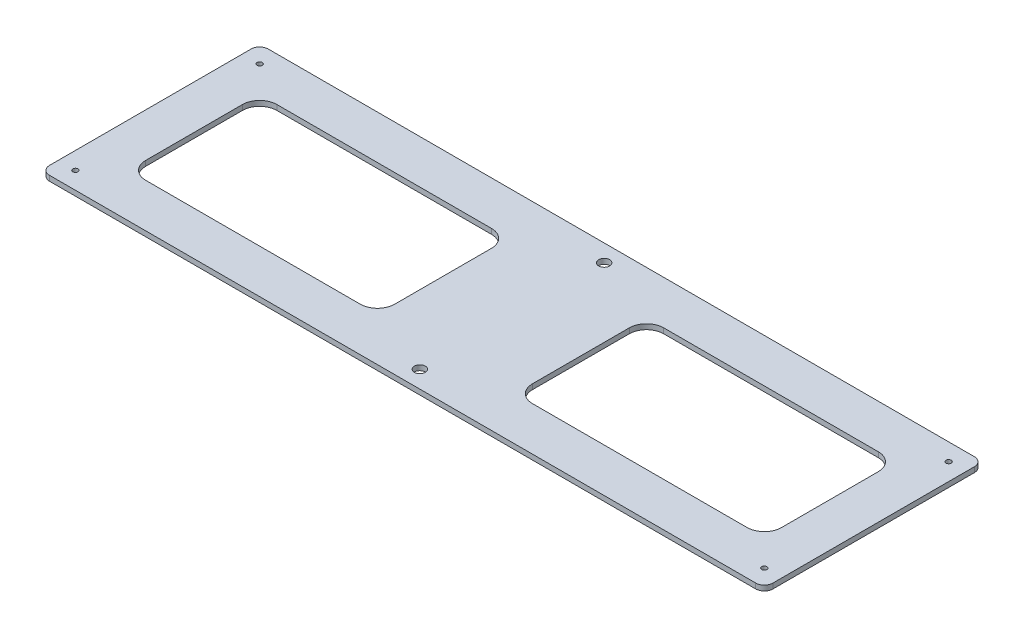
from build123d import *

# Parameters (mm, degrees)
SKETCH1_W           = 420
SKETCH1_H           = 127
BOSS_EXTRUDE1_DEPTH = 3
FILLET1_R           = 5
SKETCH2_R           = 1.5
CUT_EXTRUDE1_DEPTH  = 3
SKETCH3_W           = 144.6
SKETCH3_H           = 76.2
CUT_EXTRUDE2_DEPTH  = 3
FILLET2_R           = 10
SKETCH4_R           = 3.175
CUT_EXTRUDE3_DEPTH  = 10


with BuildPart() as part:
    # Sketch1 → Boss-Extrude1 (new body)
    with BuildSketch(Plane(origin=(0, 0, 0), x_dir=(1, 0, 0), z_dir=(0, 1, 0))):
        Rectangle(SKETCH1_W, SKETCH1_H)
    extrude(amount=BOSS_EXTRUDE1_DEPTH)

    # Fillet1
    fillet1_edges = [part.edges().sort_by_distance(p)[0] for p in [
        (210, 1.5, 63.5),
        (-210, 1.5, 63.5),
        (-210, 1.5, -63.5),
        (210, 1.5, -63.5),
    ]]
    fillet(fillet1_edges, radius=FILLET1_R)

    # Sketch2 → Cut-Extrude1 (cut)
    with BuildSketch(Plane(origin=(0, 3, 0), x_dir=(1, 0, 0), z_dir=(0, 1, 0))):
        with Locations(Location((200, -53.5, 0), (0, 0, 270))):
            Circle(SKETCH2_R)
        with Locations(Location((-200, -53.5, 0), (0, 0, 270))):
            Circle(SKETCH2_R)
        with Locations(Location((-200, 53.5, 0), (0, 0, 270))):
            Circle(SKETCH2_R)
        with Locations(Location((200, 53.5, 0), (0, 0, 270))):
            Circle(SKETCH2_R)
    extrude(amount=-CUT_EXTRUDE1_DEPTH, mode=Mode.SUBTRACT)

    # Sketch3 → Cut-Extrude2 (cut)
    with BuildSketch(Plane(origin=(0, 3, 0), x_dir=(1, 0, 0), z_dir=(0, 1, 0))):
        with Locations((112.3, 0)):
            Rectangle(SKETCH3_W, SKETCH3_H)
        with Locations((-112.3, 0)):
            Rectangle(SKETCH3_W, SKETCH3_H)
    extrude(amount=-CUT_EXTRUDE2_DEPTH, mode=Mode.SUBTRACT)

    # Fillet2
    fillet2_edges = [part.edges().sort_by_distance(p)[0] for p in [
        (-184.6, 1.5, -38.1),
        (-40, 1.5, -38.1),
        (-40, 1.5, 38.1),
        (-184.6, 1.5, 38.1),
        (184.6, 1.5, -38.1),
        (184.6, 1.5, 38.1),
        (40, 1.5, 38.1),
        (40, 1.5, -38.1),
    ]]
    fillet(fillet2_edges, radius=FILLET2_R)

    # Sketch4 → Cut-Extrude3 (cut)
    with BuildSketch(Plane(origin=(0, 3, 0), x_dir=(1, 0, 0), z_dir=(0, 1, 0))):
        with Locations(Location((0, 53.5, 0), (0, 0, 270))):
            Circle(SKETCH4_R)
        with Locations(Location((0, -53.5, 0), (0, 0, 270))):
            Circle(SKETCH4_R)
    extrude(amount=-CUT_EXTRUDE3_DEPTH, mode=Mode.SUBTRACT)


solid = part.part
